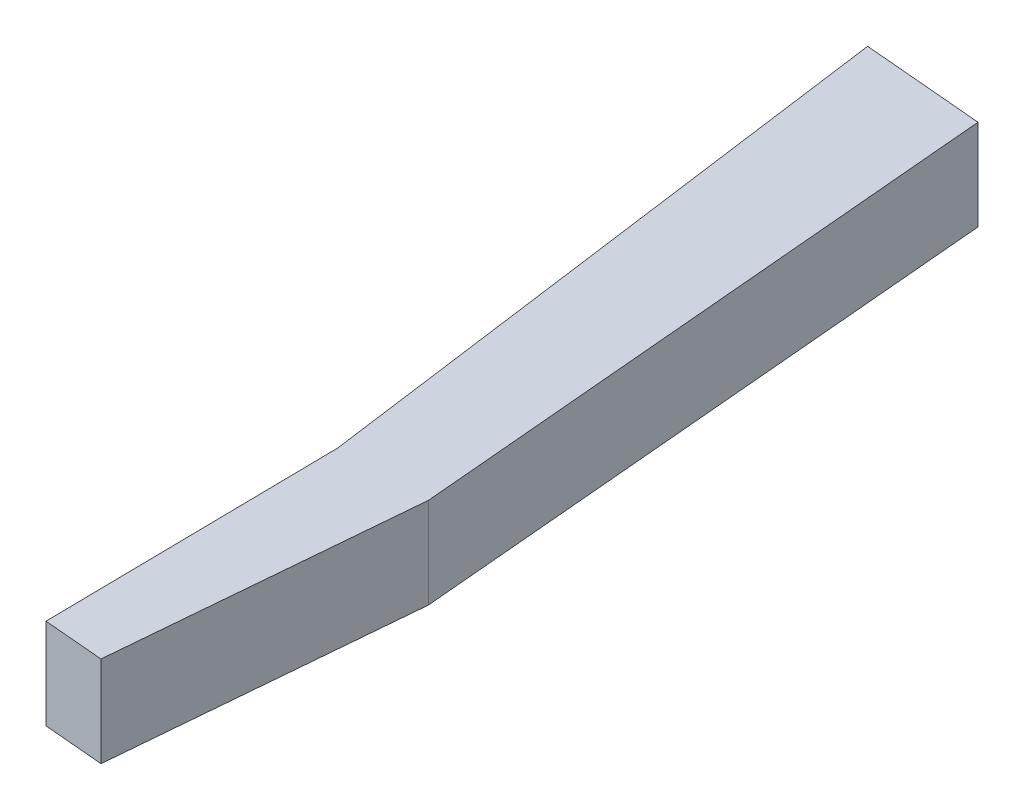
from build123d import *

# Parameters (mm, degrees)
BOSS_EXTRUDE1_DEPTH = 15


with BuildPart() as part:
    # Sketch2 → Boss-Extrude1 (new body)
    with BuildSketch(Plane(origin=(0, 0, 0), x_dir=(1, 0, 0), z_dir=(0, 1, 0))):
        Polygon((6.284425725, 99.619469809), (15, 0), (10.642212863, -49.809734905), (0.680265882, -48.938177477), (0, 0), (-13.715574275, 101.36924308), align=None)
    extrude(amount=BOSS_EXTRUDE1_DEPTH)


solid = part.part
